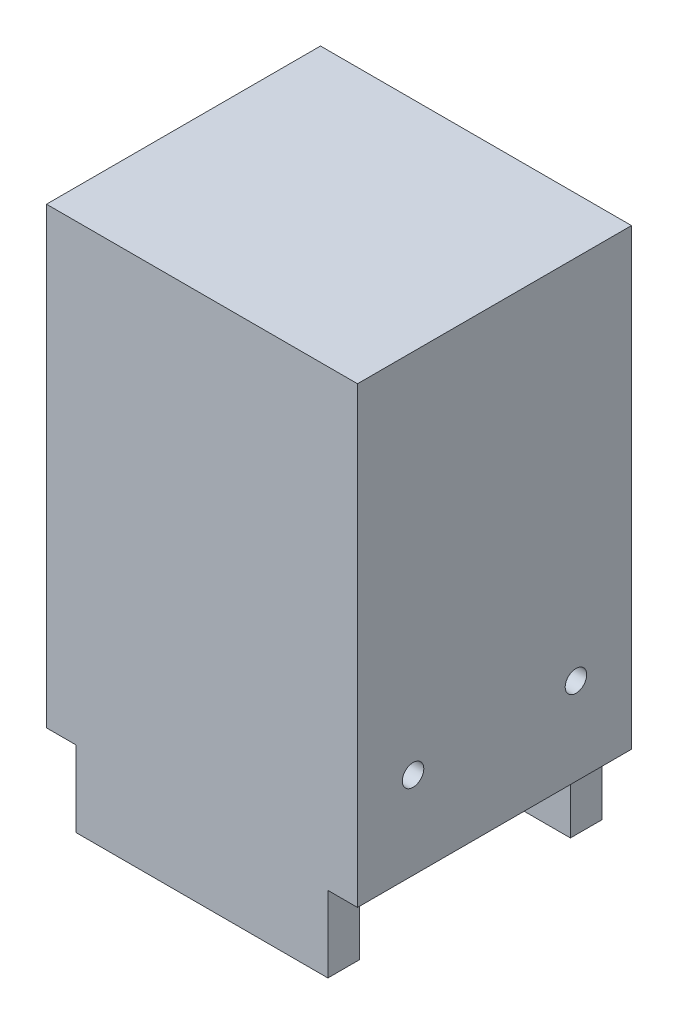
from build123d import *

# Parameters (mm, degrees)
SKETCH1_W               = 50
SKETCH1_H               = 150
BOSS_EXTRUDE1_DEPTH     = 55
CUT_EXTRUDE1_DEPTH      = 168.406690428
CUT_EXTRUDE1_DEPTH_BACK = 45
SKETCH2_R               = 10.25
SKETCH7_R               = 1
SKETCH7_R_2             = 4.25
CUT_EXTRUDE3_DEPTH      = 10
SKETCH8_W               = 55
SKETCH8_H               = 55
SKETCH8_R               = 10.25
BOSS_EXTRUDE2_DEPTH     = 50
SKETCH10_W              = 8
SKETCH10_H              = 10.25
SKETCH10_W_2            = 17
SKETCH10_H_2            = 1
SKETCH10_W_3            = 34
SKETCH10_H_3            = 20
SKETCH10_H_4            = 5
CUT_EXTRUDE4_DEPTH      = 214.717102732
SKETCH11_W              = 34
SKETCH11_H              = 13.25
BOSS_EXTRUDE4_DEPTH     = 25
SKETCH13_W              = 55
SKETCH13_H              = 10
CUT_EXTRUDE5_DEPTH      = 8
SKETCH14_R              = 5.030159043
CUT_EXTRUDE6_DEPTH      = 8
SKETCH15_W              = 34
SKETCH15_H              = 0.25
BOSS_EXTRUDE5_DEPTH     = 13.25
CUT_EXTRUDE7_DEPTH      = 181.416185527
BOSS_EXTRUDE6_START     = 1.5
SKETCH19_R              = 10.25
SKETCH19_R_2            = 1
SKETCH19_R_3            = 4.25
BOSS_EXTRUDE6_DEPTH     = 1.5
CUT_EXTRUDE8_DEPTH      = 184.89467094
SKETCH21_R              = 5.030159043
SKETCH21_R_2            = 4.5
BOSS_EXTRUDE7_DEPTH     = 8
SKETCH24_W              = 4
SKETCH24_H              = 30
CUT_EXTRUDE10_DEPTH     = 181.416185527
SKETCH25_W              = 55
SKETCH25_H              = 86.25
CUT_EXTRUDE11_DEPTH     = 4
BOSS_EXTRUDE8_START     = 4
SKETCH26_R              = 1
SKETCH26_R_2            = 4.25
BOSS_EXTRUDE8_DEPTH     = 4
SKETCH27_W              = 4
SKETCH27_H              = 123.25
CUT_EXTRUDE12_DEPTH     = 181.416185527
CUT_EXTRUDE13_DEPTH     = 180.905530765
SKETCH29_W              = 42
SKETCH29_H              = 9
CUT_EXTRUDE15_DEPTH     = 174.776436838
SKETCH30_R              = 4.5
SKETCH30_R_2            = 1.45
BOSS_EXTRUDE9_DEPTH     = 4
SKETCH31_W              = 37
SKETCH31_H              = 55
CUT_EXTRUDE16_DEPTH     = 182.05247858
SKETCH32_W              = 93.338891709
SKETCH32_H              = 62.145945894
CUT_EXTRUDE17_DEPTH     = 182.05247858


with BuildPart() as part:
    # Sketch1 → Boss-Extrude1 (new body)
    with BuildSketch(Plane.XY):
        with Locations((0, -75)):
            Rectangle(SKETCH1_W, SKETCH1_H)
    extrude(amount=-BOSS_EXTRUDE1_DEPTH)

    # Sketch2 → Cut-Extrude1 (cut, two sides: drawn at the far end of the back side and taken through both)
    with BuildSketch(Plane(origin=(25, 0, 0), x_dir=(0, 0, -1), z_dir=(1, 0, 0)).offset(-CUT_EXTRUDE1_DEPTH_BACK)):
        with Locations(Location((27.5, -25, 0), (0, 0, 270))):
            Circle(SKETCH2_R)
    extrude(amount=CUT_EXTRUDE1_DEPTH + CUT_EXTRUDE1_DEPTH_BACK, mode=Mode.SUBTRACT)

    # Sketch7 → Cut-Extrude3 (cut)
    with BuildSketch(Plane(origin=(-20, 0, 0), x_dir=(0, 0, -1), z_dir=(1, 0, 0))):
        with Locations(Location((27.5, -17, 0), (0, 0, 90))):
            Circle(SKETCH7_R)
        with Locations(Location((35.5, -25, 0), (0, 0, 90))):
            Circle(SKETCH7_R)
        with Locations(Location((27.5, -33, 0), (0, 0, 90))):
            Circle(SKETCH7_R)
        with Locations(Location((19.5, -25, 0), (0, 0, 90))):
            Circle(SKETCH7_R)
        with Locations(Location((27.5, -25, 0), (0, 0, 90))):
            Circle(SKETCH7_R_2)
    extrude(amount=-CUT_EXTRUDE3_DEPTH, mode=Mode.SUBTRACT)

    # Sketch8 → Boss-Extrude2 (add)
    with BuildSketch(Plane(origin=(25, 0, 0), x_dir=(0, 0, -1), z_dir=(1, 0, 0))):
        with Locations((27.5, -177.5)):
            Rectangle(SKETCH8_W, SKETCH8_H)
        with Locations(Location((27.5, -180, 0), (0, 0, 90))):
            Circle(SKETCH8_R, mode=Mode.SUBTRACT)
    extrude(amount=-BOSS_EXTRUDE2_DEPTH)

    # Sketch10 → Cut-Extrude4 (cut, through all)
    with BuildSketch(Plane.XY):
        Polygon((-17, -205), (17, -205), (17, -191.25), (0, -191.25), (-17, -191.25), align=None)
        Polygon((-25, -205), (-17, -205), (-17, -191.25), (-17, -190.25), (-25, -190.25), align=None)
        Polygon((17, -191.25), (17, -205), (25, -205), (25, -190.25), (17, -190.25), align=None)
        with Locations((-21, -185.125)):
            Rectangle(SKETCH10_W, SKETCH10_H)
        with Locations((-21, -174.875)):
            Rectangle(SKETCH10_W, SKETCH10_H)
        with Locations((21, -174.875)):
            Rectangle(SKETCH10_W, SKETCH10_H)
        with Locations((21, -185.125)):
            Rectangle(SKETCH10_W, SKETCH10_H)
        with Locations((-8.5, -185.125)):
            Rectangle(SKETCH10_W_2, SKETCH10_H)
        with Locations((8.5, -185.125)):
            Rectangle(SKETCH10_W_2, SKETCH10_H)
        Polygon((0, -180), (17, -180), (17, -169.75), (-17, -169.75), (-17, -180), align=None)
        with Locations((-8.5, -190.75)):
            Rectangle(SKETCH10_W_2, SKETCH10_H_2)
        with Locations((8.5, -190.75)):
            Rectangle(SKETCH10_W_2, SKETCH10_H_2)
        with Locations((0, -154.75)):
            Rectangle(SKETCH10_W_3, SKETCH10_H_3)
        with Locations((0, -167.25)):
            Rectangle(SKETCH10_W_3, SKETCH10_H_4)
    extrude(amount=-CUT_EXTRUDE4_DEPTH, mode=Mode.SUBTRACT)

    # Sketch11 → Boss-Extrude4 (add)
    with BuildSketch(Plane.XZ.offset(144.75)):
        with Locations((0, -6.625)):
            Rectangle(SKETCH11_W, SKETCH11_H)
        with Locations((0, -48.375)):
            Rectangle(SKETCH11_W, SKETCH11_H)
    extrude(amount=BOSS_EXTRUDE4_DEPTH)

    # Sketch13 → Cut-Extrude5 (cut)
    with BuildSketch(Plane(origin=(25, 0, 0), x_dir=(0, 0, -1), z_dir=(1, 0, 0))):
        with Locations((27.5, -164.75)):
            Rectangle(SKETCH13_W, SKETCH13_H)
    cut_extrude5 = extrude(amount=-CUT_EXTRUDE5_DEPTH, mode=Mode.SUBTRACT)

    # Mirror2: Cut-Extrude5 across plane
    add(cut_extrude5.mirror(Plane(origin=(0, 0, 0), x_dir=(0, 0, 1), z_dir=(1, 0, 0))), mode=Mode.SUBTRACT)

    # Sketch14 → Cut-Extrude6 (cut)
    with BuildSketch(Plane(origin=(25, 0, 0), x_dir=(0, 0, -1), z_dir=(1, 0, 0))):
        with Locations(Location((16.5, -148, 0), (0, 0, 90))):
            Circle(SKETCH14_R)
        with Locations(Location((38.5, -148, 0), (0, 0, 90))):
            Circle(SKETCH14_R)
    cut_extrude6 = extrude(amount=-CUT_EXTRUDE6_DEPTH, mode=Mode.SUBTRACT)

    # Mirror3: Cut-Extrude6 across plane
    add(cut_extrude6.mirror(Plane(origin=(0, 0, 0), x_dir=(0, 0, 1), z_dir=(1, 0, 0))), mode=Mode.SUBTRACT)

    # Sketch15 → Boss-Extrude5 (add)
    with BuildSketch(Plane.XY):
        with Locations((0, -169.875)):
            Rectangle(SKETCH15_W, SKETCH15_H)
    boss_extrude5 = extrude(amount=-BOSS_EXTRUDE5_DEPTH)

    # Mirror4: Boss-Extrude5 across plane
    add(boss_extrude5.mirror(Plane.XY.offset(-27.5)))

    # Sketch16 → Cut-Extrude7 (cut, through all)
    with BuildSketch(Plane.XY):
        Polygon((-18.5, 0), (-18.5, -14.75), (-18.5, -35.25), (-18.5, -43.5), (25, -43.5), (25, 0), align=None)
    extrude(amount=-CUT_EXTRUDE7_DEPTH, mode=Mode.SUBTRACT)

    # Sketch19 → Boss-Extrude6 (add)
    with BuildSketch(Plane(origin=(-20, 0, 0), x_dir=(0, 0, -1), z_dir=(1, 0, 0)).offset(BOSS_EXTRUDE6_START)):
        with Locations((27.5, -25)):
            Circle(SKETCH19_R)
        with Locations(Location((27.5, -17, 0), (0, 0, 90))):
            Circle(SKETCH19_R_2, mode=Mode.SUBTRACT)
        with Locations(Location((27.5, -33, 0), (0, 0, 90))):
            Circle(SKETCH19_R_2, mode=Mode.SUBTRACT)
        with Locations(Location((19.5, -25, 0), (0, 0, 90))):
            Circle(SKETCH19_R_2, mode=Mode.SUBTRACT)
        with Locations(Location((35.5, -25, 0), (0, 0, 90))):
            Circle(SKETCH19_R_2, mode=Mode.SUBTRACT)
        with Locations(Location((27.5, -25, 0), (0, 0, 90))):
            Circle(SKETCH19_R_3, mode=Mode.SUBTRACT)
    extrude(amount=-BOSS_EXTRUDE6_DEPTH)

    # Sketch20 → Cut-Extrude8 (cut, through all)
    with BuildSketch(Plane(origin=(-18.5, 0, 0), x_dir=(0, 0, -1), z_dir=(1, 0, 0))):
        with BuildLine():
            Line((0, 0), (0, -43.5))
            Line((0, -43.5), (9, -43.5))
            Line((9, -43.5), (9, -25))
            ThreePointArc((9, -25), (27.5, -6.5), (46, -25))
            Line((46, -25), (46, -43.5))
            Line((46, -43.5), (55, -43.5))
            Line((55, -43.5), (55, 0))
            Line((55, 0), (0, 0))
        make_face()
    extrude(amount=-CUT_EXTRUDE8_DEPTH, mode=Mode.SUBTRACT)

    # Sketch21 → Boss-Extrude7 (add)
    # profile 1 of 2: a face of its own
    with BuildSketch(Plane(origin=(25, 0, 0), x_dir=(0, 0, -1), z_dir=(1, 0, 0))):
        with Locations(Location((16.5, -148, 0), (0, 0, 229.751587581))):
            Circle(SKETCH21_R)
        with Locations(Location((16.5, -148, 0), (0, 0, 90))):
            Circle(SKETCH21_R_2, mode=Mode.SUBTRACT)
    # profile 2 of 2: a face of its own
    with BuildSketch(Plane(origin=(25, 0, 0), x_dir=(0, 0, -1), z_dir=(1, 0, 0))):
        with Locations(Location((38.5, -148, 0), (0, 0, 310.248412419))):
            Circle(SKETCH21_R)
        with Locations(Location((38.5, -148, 0), (0, 0, 90))):
            Circle(SKETCH21_R_2, mode=Mode.SUBTRACT)
    boss_extrude7 = extrude(amount=-BOSS_EXTRUDE7_DEPTH)

    # Mirror5: Boss-Extrude7 across plane
    add(boss_extrude7.mirror(Plane(origin=(0, 0, 0), x_dir=(0, 0, 1), z_dir=(1, 0, 0))))

    # Sketch24 → Cut-Extrude10 (cut, through all)
    with BuildSketch(Plane.XY):
        with Locations((-23, -144.75)):
            Rectangle(SKETCH24_W, SKETCH24_H)
        with Locations((23, -144.75)):
            Rectangle(SKETCH24_W, SKETCH24_H)
    extrude(amount=-CUT_EXTRUDE10_DEPTH, mode=Mode.SUBTRACT)

    # Sketch25 → Cut-Extrude11 (cut)
    with BuildSketch(Plane(origin=(25, 0, 0), x_dir=(0, 0, -1), z_dir=(1, 0, 0))):
        with Locations((27.5, -86.625)):
            Rectangle(SKETCH25_W, SKETCH25_H)
    extrude(amount=-CUT_EXTRUDE11_DEPTH, mode=Mode.SUBTRACT)

    # Sketch26 → Boss-Extrude8 (add)
    with BuildSketch(Plane(origin=(-18.5, 0, 0), x_dir=(0, 0, -1), z_dir=(1, 0, 0)).offset(BOSS_EXTRUDE8_START)):
        with BuildLine():
            Line((46, -43.5), (46, -25))
            ThreePointArc((46, -25), (27.5, -6.5), (9, -25))
            Line((9, -25), (9, -43.5))
            Line((9, -43.5), (46, -43.5))
        make_face()
        with Locations(Location((35.5, -25, 0), (0, 0, 90))):
            Circle(SKETCH26_R, mode=Mode.SUBTRACT)
        with Locations(Location((27.5, -25, 0), (0, 0, 90))):
            Circle(SKETCH26_R_2, mode=Mode.SUBTRACT)
        with Locations(Location((19.5, -25, 0), (0, 0, 90))):
            Circle(SKETCH26_R, mode=Mode.SUBTRACT)
        with Locations(Location((27.5, -33, 0), (0, 0, 90))):
            Circle(SKETCH26_R, mode=Mode.SUBTRACT)
        with Locations(Location((27.5, -17, 0), (0, 0, 90))):
            Circle(SKETCH26_R, mode=Mode.SUBTRACT)
    extrude(amount=-BOSS_EXTRUDE8_DEPTH)

    # Sketch27 → Cut-Extrude12 (cut, through all)
    with BuildSketch(Plane.XY):
        with Locations((-23, -68.125)):
            Rectangle(SKETCH27_W, SKETCH27_H)
    extrude(amount=-CUT_EXTRUDE12_DEPTH, mode=Mode.SUBTRACT)

    # Sketch28 → Cut-Extrude13 (cut, through all)
    with BuildSketch(Plane.XY):
        with BuildLine():
            Line((21, -43.5), (-14.5, -43.5))
            ThreePointArc((-14.5, -43.5), (10.602290732, -53.897709268), (21, -79))
            Line((21, -79), (21, -43.5))
        make_face()
    extrude(amount=-CUT_EXTRUDE13_DEPTH, mode=Mode.SUBTRACT)

    # Sketch29 → Cut-Extrude15 (cut, through all)
    with BuildSketch(Plane.XZ.offset(170)):
        with Locations((0, -50.5)):
            Rectangle(SKETCH29_W, SKETCH29_H)
        with Locations((0, -4.5)):
            Rectangle(SKETCH29_W, SKETCH29_H)
    extrude(amount=-CUT_EXTRUDE15_DEPTH, mode=Mode.SUBTRACT)

    # Sketch30 → Boss-Extrude9 (add)
    # profile 1 of 2: a face of its own
    with BuildSketch(Plane(origin=(21, 0, 0), x_dir=(0, 0, -1), z_dir=(1, 0, 0))):
        with Locations(Location((16.5, -148, 0), (0, 0, 223.761742693))):
            Circle(SKETCH30_R)
        with Locations((16.5, -148)):
            Circle(SKETCH30_R_2, mode=Mode.SUBTRACT)
    # profile 2 of 2: a face of its own
    with BuildSketch(Plane(origin=(21, 0, 0), x_dir=(0, 0, -1), z_dir=(1, 0, 0))):
        with Locations(Location((38.5, -148, 0), (0, 0, 316.238257307))):
            Circle(SKETCH30_R)
        with Locations((38.5, -148)):
            Circle(SKETCH30_R_2, mode=Mode.SUBTRACT)
    boss_extrude9 = extrude(amount=-BOSS_EXTRUDE9_DEPTH)

    # Mirror6: Boss-Extrude9 across plane
    add(boss_extrude9.mirror(Plane(origin=(0, 0, 0), x_dir=(0, 0, 1), z_dir=(1, 0, 0))))

    # Sketch31 → Cut-Extrude16 (cut, through all)
    with BuildSketch(Plane.ZY.offset(21)):
        with Locations((-27.5, -71)):
            Rectangle(SKETCH31_W, SKETCH31_H)
    extrude(amount=-CUT_EXTRUDE16_DEPTH, mode=Mode.SUBTRACT)


with BuildPart() as cut_extrude16_piece_1:
    # of the separate pieces the step leaves, piece 1, a body of its own (cut_extrude16_pieces)
    add(part.part.solids().sort_by_distance((17, -170, -13.25))[0])


with BuildPart() as cut_extrude16_piece_2:
    # of the separate pieces the step leaves, piece 2, a body of its own (cut_extrude16_pieces)
    add(part.part.solids().sort_by_distance((-21, -43.5, -9))[0])

    # Sketch32 → Cut-Extrude17 (cut, through all)
    with BuildSketch(Plane.ZY.offset(21)):
        with Locations((-22.821058128, -34.382182034)):
            Rectangle(SKETCH32_W, SKETCH32_H)
    extrude(amount=-CUT_EXTRUDE17_DEPTH, mode=Mode.SUBTRACT)


solid = cut_extrude16_piece_1.part
